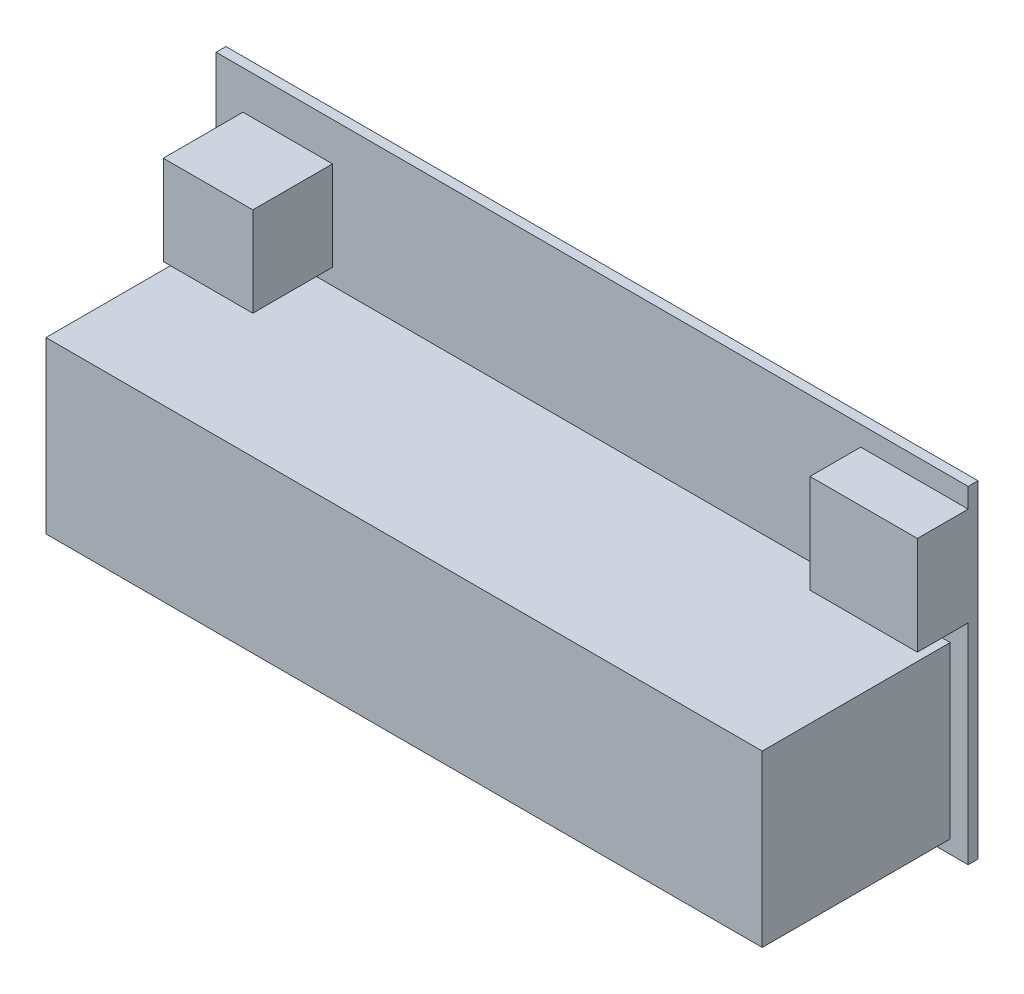
from build123d import *

# Parameters (mm, degrees)
SKETCH_1_W      = 84
SKETCH_1_H      = 36.6
EXTRUDE_1_DEPTH = 1.1
SKETCH_2_W      = 10
SKETCH_2_H      = 10
EXTRUDE_2_DEPTH = 8.9
SKETCH_3_W      = 12
SKETCH_3_H      = 11
EXTRUDE_3_DEPTH = 5.67
SKETCH_4_W      = 80
SKETCH_4_H      = 19
EXTRUDE_4_DEPTH = 21


with BuildPart() as part:
    # 草圖1 → 填料-伸長1 (new body)
    with BuildSketch(Plane.XY):
        with Locations((14.318128929, -7.904225352)):
            Rectangle(SKETCH_1_W, SKETCH_1_H)
    extrude(amount=EXTRUDE_1_DEPTH)

    # 草圖2 → 填料-伸長2 (add)
    with BuildSketch(Plane.XY.offset(1.1)):
        with Locations((-19.681871071, 1.095774648)):
            Rectangle(SKETCH_2_W, SKETCH_2_H)
    extrude(amount=EXTRUDE_2_DEPTH)

    # 草圖3 → 填料-伸長3 (add)
    with BuildSketch(Plane.XY.offset(1.1)):
        with Locations((50.318128929, 2.695774648)):
            Rectangle(SKETCH_3_W, SKETCH_3_H)
    extrude(amount=EXTRUDE_3_DEPTH)

    # 草圖4 → 填料-伸長4 (add)
    with BuildSketch(Plane.XY.offset(1.1)):
        with Locations((14.318128929, -15.204225352)):
            Rectangle(SKETCH_4_W, SKETCH_4_H)
    extrude(amount=EXTRUDE_4_DEPTH)


solid = part.part
